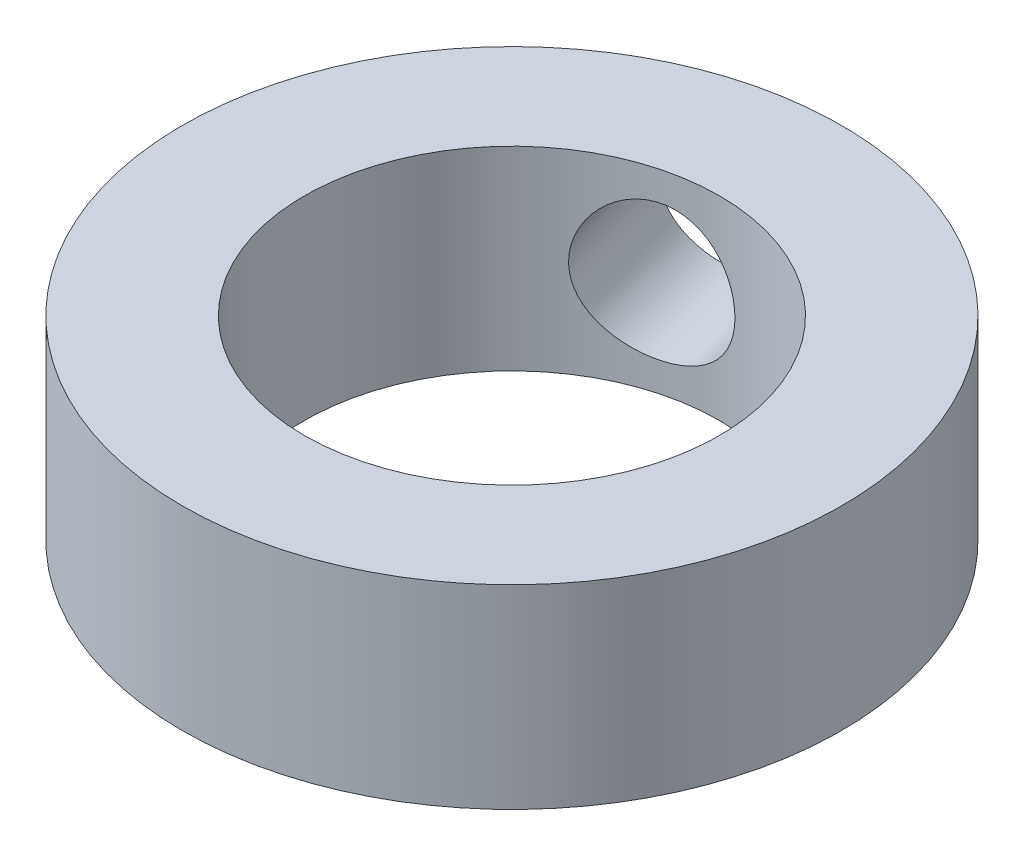
from build123d import *

# Parameters (mm, degrees)
SKETCH1_R                        = 25.4
BOSS_EXTRUDE1_DEPTH              = 15
SKETCH2_R                        = 16
CUT_EXTRUDE1_DEPTH               = 15
F_10_5_10_5_DIAMETER_HOLE1_D     = 10.5
F_10_5_10_5_DIAMETER_HOLE1_DEPTH = 30
F_10_5_10_5_DIAMETER_HOLE1_TIP   = 3.15451825


with BuildPart() as part:
    # Sketch1 → Boss-Extrude1 (new body)
    with BuildSketch(Plane(origin=(0, 0, 0), x_dir=(1, 0, 0), z_dir=(0, 1, 0))):
        with Locations(Location((0, 0, 0), (0, 0, 270))):
            Circle(SKETCH1_R)
    extrude(amount=BOSS_EXTRUDE1_DEPTH)

    # Sketch2 → Cut-Extrude1 (cut)
    with BuildSketch(Plane(origin=(0, 15, 0), x_dir=(1, 0, 0), z_dir=(0, 1, 0))):
        with Locations(Location((0, 0, 0), (0, 0, 270))):
            Circle(SKETCH2_R)
    extrude(amount=-CUT_EXTRUDE1_DEPTH, mode=Mode.SUBTRACT)

    # Ø10.5 (10.5) Diameter Hole1
    with Locations(Plane(origin=(-6.456859903, 7.5, -24.565605228), x_dir=(-0.967149812109, 0, 0.254207082784), z_dir=(-0.254207082784, 0, -0.967149812109))):
        with Locations((0, 0)):
            Hole(F_10_5_10_5_DIAMETER_HOLE1_D / 2, depth=F_10_5_10_5_DIAMETER_HOLE1_DEPTH)
            with Locations((0, 0, -(F_10_5_10_5_DIAMETER_HOLE1_DEPTH + F_10_5_10_5_DIAMETER_HOLE1_TIP / 2))):  # 118° drill point
                Cone(0, F_10_5_10_5_DIAMETER_HOLE1_D / 2, F_10_5_10_5_DIAMETER_HOLE1_TIP, mode=Mode.SUBTRACT)


solid = part.part
